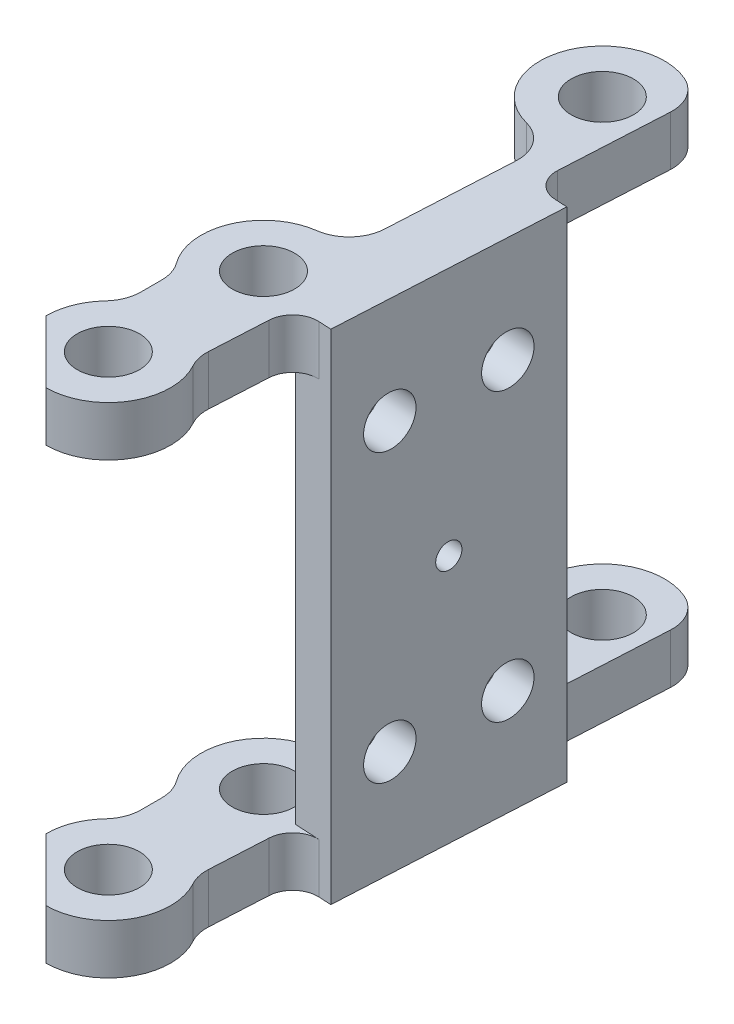
from build123d import *

# Parameters (mm, degrees)
SKETCH2_R           = 2.5
BOSS_EXTRUDE3_DEPTH = 4
BOSS_EXTRUDE4_DEPTH = 40
FILLET1_R           = 2
SKETCH4_R           = 2
SKETCH4_R_2         = 1
CUT_EXTRUDE1_DEPTH  = 10
FILLET3_R           = 3
FILLET4_R           = 3


with BuildPart() as part:
    # Sketch2 → Boss-Extrude3 (new body)
    with BuildSketch(Plane(origin=(0, 0, 0), x_dir=(1, 0, 0), z_dir=(0, 1, 0))):
        with BuildLine():
            ThreePointArc((83.62627208, 73.409646321), (82.043328915, 71.619198109), (81.472187529, 69.298592288))
            Line((81.472187529, 69.298592288), (86.472187529, 64.298592288))
            ThreePointArc((86.472187529, 64.298592288), (90.961711336, 67.097643404), (90.424672494, 72.360921892))
            Line((90.424672494, 72.360921892), (90.926689774, 81.686644374))
            Line((90.926689774, 81.686644374), (92.048119667, 102.518883374))
            Line((92.048119667, 102.518883374), (92.450855554, 110.000305351))
            ThreePointArc((92.450855554, 110.000305351), (83.843337657, 108.444197301), (89.726552777, 101.971283238))
            Line((89.726552777, 101.971283238), (88.863578179, 85.80252536))
            ThreePointArc((88.863578179, 85.80252536), (82.866493913, 83.799788509), (83.62627208, 77.522949199))
            Line((83.62627208, 77.522949199), (83.62627208, 73.409646321))
        make_face()
        with Locations(Location((86.472187529, 69.298592288, 0), (0, 0, 270))):
            Circle(SKETCH2_R, mode=Mode.SUBTRACT)
        with Locations(Location((87.092070964, 81.126869023, 0), (0, 0, 270))):
            Circle(SKETCH2_R, mode=Mode.SUBTRACT)
        with Locations(Location((88.578200606, 106.837625529, 0), (0, 0, 270))):
            Circle(SKETCH2_R, mode=Mode.SUBTRACT)
    boss_extrude3 = extrude(amount=BOSS_EXTRUDE3_DEPTH)

    # Sketch3 → Boss-Extrude4 (add)
    with BuildSketch(Plane(origin=(0, 4, 0), x_dir=(1, 0, 0), z_dir=(0, 1, 0))):
        Polygon((91.800965367, 97.92762227), (90.833399946, 79.953646162), (93.833399946, 79.792151774), (94.800965367, 97.766127883), align=None)
    extrude(amount=-BOSS_EXTRUDE4_DEPTH)

    # Mirror1: Boss-Extrude3 across plane
    add(boss_extrude3.mirror(Plane.ZX.offset(-16)))

    # Fillet1
    fillet1_edges = [part.edges().sort_by_distance(p)[0] for p in [
        (90.833399946, -34, -79.953646162),
        (91.800965367, -34, -97.92762227),
        (91.800965367, 2, -97.92762227),
        (90.833399946, 2, -79.953646162),
    ]]
    fillet(fillet1_edges, radius=FILLET1_R)

    # Sketch4 → Cut-Extrude1 (cut)
    with BuildSketch(Plane(origin=(86.279355648, 0, 4.6445439), x_dir=(-0.05375363451621944, 0, 0.9985542282601866), z_dir=(-0.9985542282601865, 0, -0.05375363451621943))):
        with Locations((-89.220676822, -4.5)):
            Circle(SKETCH4_R)
        with Locations(Location((-98.220676822, -4.5, 0), (0, 0, 180))):
            Circle(SKETCH4_R)
        with Locations(Location((-89.220676822, -27.5, 0), (0, 0, 180))):
            Circle(SKETCH4_R)
        with Locations((-98.220676822, -27.5)):
            Circle(SKETCH4_R)
        with Locations((-93.720676822, -16)):
            Circle(SKETCH4_R_2)
    extrude(amount=-CUT_EXTRUDE1_DEPTH, mode=Mode.SUBTRACT)

    # Fillet3
    fillet3_edges = [part.edges().sort_by_distance(p)[0] for p in [
        (92.450855554, 2, -110.000305351),
        (90.424672494, 2, -72.360921892),
        (83.62627208, 2, -73.409646321),
        (83.62627208, 2, -77.522949199),
        (89.726552777, 2, -101.971283238),
        (92.450855554, -34, -110.000305351),
        (89.726552777, -34, -101.971283238),
        (90.424672494, -34, -72.360921892),
        (83.62627208, -34, -73.409646321),
        (83.62627208, -34, -77.522949199),
    ]]
    fillet(fillet3_edges, radius=FILLET3_R)

    # Fillet4
    fillet4_edges = [part.edges().sort_by_distance(p)[0] for p in [
        (88.863578179, 2, -85.80252536),
        (88.863578179, -34, -85.80252536),
    ]]
    fillet(fillet4_edges, radius=FILLET4_R)


solid = part.part
